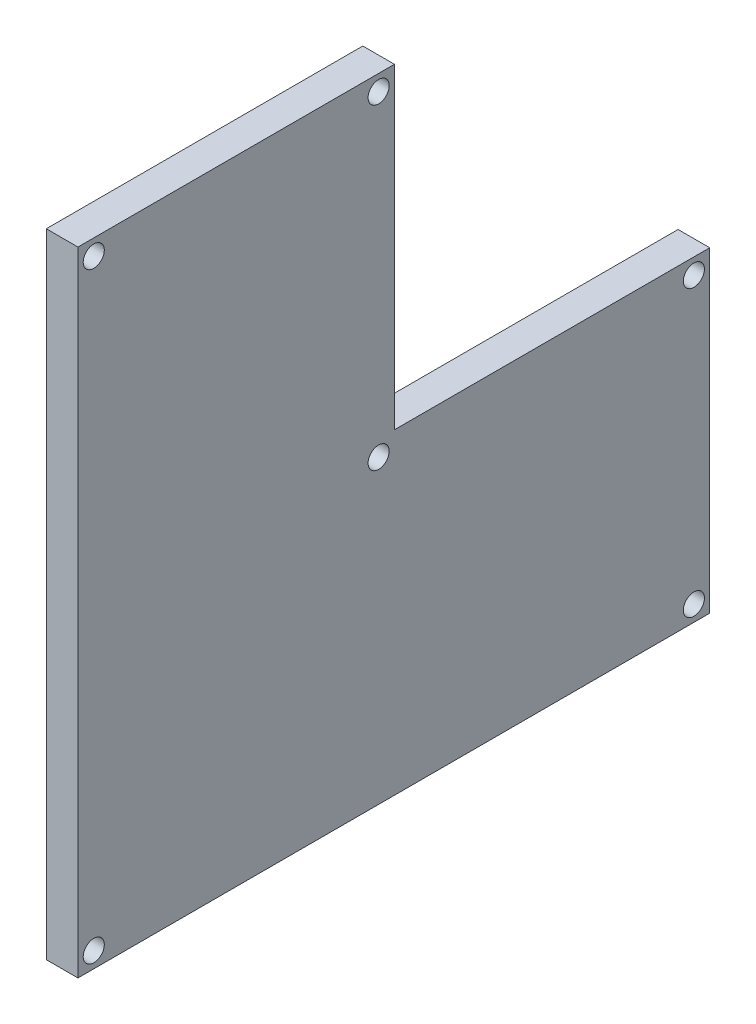
from build123d import *

# Parameters (mm, degrees)
ESQUISSE1_W             = 29.88
ESQUISSE1_H             = 30
ESQUISSE1_W_2           = 30
BOSS_EXTRU_1_DEPTH      = 3
ENL_V_MAT_EXTRU_1_DEPTH = 3


with BuildPart() as part:
    # Esquisse1 → Boss.-Extru.1 (new body)
    with BuildSketch(Plane(origin=(0, 0, 0), x_dir=(0, 0, -1), z_dir=(1, 0, 0))):
        with Locations((29.757813765, -25.688259109)):
            Rectangle(ESQUISSE1_W, ESQUISSE1_H)
        with Locations((-0.182186235, -25.688259109)):
            Rectangle(ESQUISSE1_W_2, ESQUISSE1_H)
        with Locations((-0.182186235, 4.311740891)):
            Rectangle(ESQUISSE1_W_2, ESQUISSE1_H)
    extrude(amount=BOSS_EXTRU_1_DEPTH)

    # Esquisse2 → Enlèv. mat.-Extru.1 (cut)
    with BuildSketch(Plane.ZY):
        with BuildLine():
            ThreePointArc((-42.197813765, -39.188259109), (-42.273934233, -38.805575677), (-42.490706984, -38.481152328))
            Line((-42.490706984, -38.481152328), (-43.904920546, -39.89536589))
            ThreePointArc((-43.904920546, -39.89536589), (-42.815130333, -40.112138642), (-42.197813765, -39.188259109))
        make_face()
        with BuildLine():
            Line((-43.904920546, -39.89536589), (-42.490706984, -38.481152328))
            ThreePointArc((-42.490706984, -38.481152328), (-43.904920546, -38.481152328), (-43.904920546, -39.89536589))
        make_face()
        with BuildLine():
            ThreePointArc((-43.904920546, -11.481152328), (-43.904920546, -12.89536589), (-42.490706984, -12.89536589))
            Line((-42.490706984, -12.89536589), (-43.904920546, -11.481152328))
        make_face()
        with BuildLine():
            Line((-43.904920546, -11.481152328), (-42.490706984, -12.89536589))
            ThreePointArc((-42.490706984, -12.89536589), (-42.273934233, -12.570942542), (-42.197813765, -12.188259109))
            ThreePointArc((-42.197813765, -12.188259109), (-42.815130333, -11.264379577), (-43.904920546, -11.481152328))
        make_face()
        with BuildLine():
            ThreePointArc((-14.024920546, -11.481152328), (-14.024920546, -12.89536589), (-12.610706984, -12.89536589))
            Line((-12.610706984, -12.89536589), (-14.024920546, -11.481152328))
        make_face()
        with BuildLine():
            Line((-14.024920546, -11.481152328), (-12.610706984, -12.89536589))
            ThreePointArc((-12.610706984, -12.89536589), (-12.393934233, -12.570942542), (-12.317813765, -12.188259109))
            ThreePointArc((-12.317813765, -12.188259109), (-12.935130333, -11.264379577), (-14.024920546, -11.481152328))
        make_face()
        with BuildLine():
            ThreePointArc((-14.024920546, 18.518847672), (-14.024920546, 17.10463411), (-12.610706984, 17.10463411))
            Line((-12.610706984, 17.10463411), (-14.024920546, 18.518847672))
        make_face()
        with BuildLine():
            Line((-14.024920546, 18.518847672), (-12.610706984, 17.10463411))
            ThreePointArc((-12.610706984, 17.10463411), (-12.393934233, 17.429057458), (-12.317813765, 17.811740891))
            ThreePointArc((-12.317813765, 17.811740891), (-12.935130333, 18.735620423), (-14.024920546, 18.518847672))
        make_face()
        with BuildLine():
            ThreePointArc((14.389293016, 18.518847672), (12.975079454, 18.518847672), (12.975079454, 17.10463411))
            Line((12.975079454, 17.10463411), (14.389293016, 18.518847672))
        make_face()
        with BuildLine():
            Line((14.389293016, 18.518847672), (12.975079454, 17.10463411))
            ThreePointArc((12.975079454, 17.10463411), (14.064869667, 16.887861358), (14.682186235, 17.811740891))
            ThreePointArc((14.682186235, 17.811740891), (14.606065767, 18.194424323), (14.389293016, 18.518847672))
        make_face()
        with BuildLine():
            ThreePointArc((14.682186235, -39.188259109), (14.064869667, -38.264379577), (12.975079454, -38.481152328))
            Line((12.975079454, -38.481152328), (14.389293016, -39.89536589))
            ThreePointArc((14.389293016, -39.89536589), (14.606065767, -39.570942542), (14.682186235, -39.188259109))
        make_face()
        with BuildLine():
            Line((14.389293016, -39.89536589), (12.975079454, -38.481152328))
            ThreePointArc((12.975079454, -38.481152328), (12.975079454, -39.89536589), (14.389293016, -39.89536589))
        make_face()
    extrude(amount=-ENL_V_MAT_EXTRU_1_DEPTH, mode=Mode.SUBTRACT)


solid = part.part
